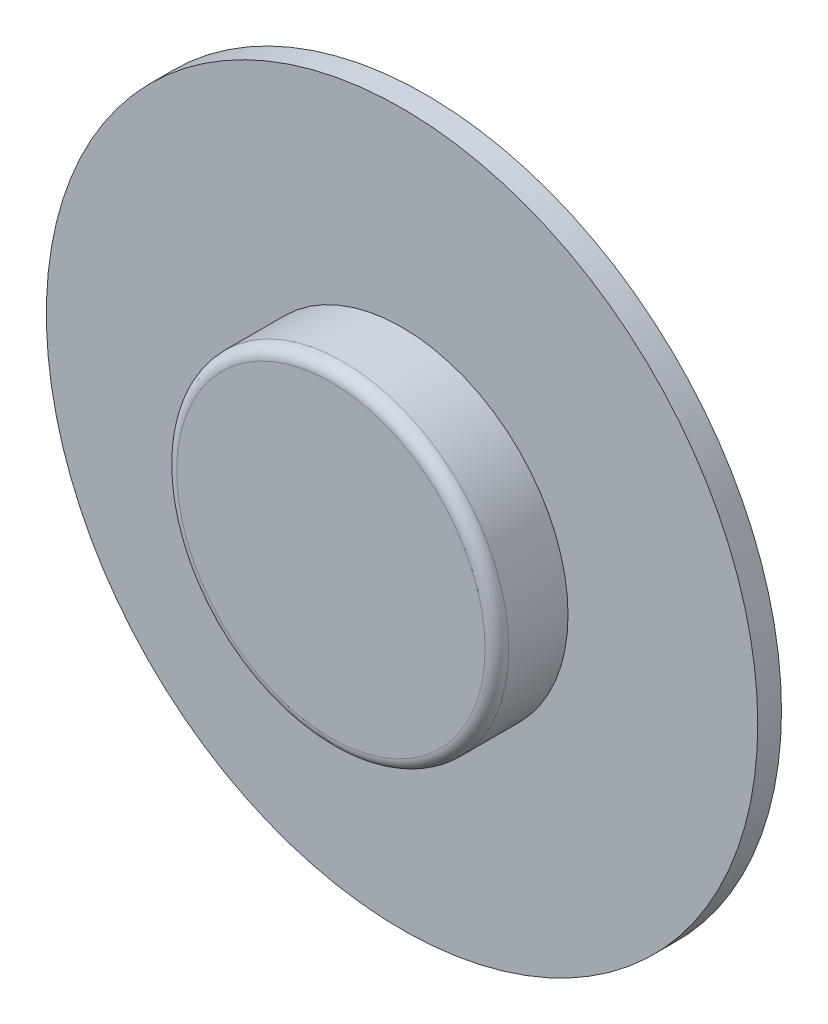
from build123d import *

# Parameters (mm, degrees)
ESQUISSE1_R        = 15
BOSS_EXTRU_1_DEPTH = 1
ESQUISSE2_R        = 7
BOSS_EXTRU_2_DEPTH = 3
CONG_1_R           = 0.5
ESQUISSE3_R        = 4
BOSS_EXTRU_3_DEPTH = 5


with BuildPart() as part:
    # Esquisse1 → Boss.-Extru.1 (new body)
    with BuildSketch(Plane.XY):
        Circle(ESQUISSE1_R)
    extrude(amount=BOSS_EXTRU_1_DEPTH)

    # Esquisse2 → Boss.-Extru.2 (add)
    with BuildSketch(Plane.XY.offset(1)):
        Circle(ESQUISSE2_R)
    extrude(amount=BOSS_EXTRU_2_DEPTH)

    # Congé1
    cong_1_edges = [part.edges().sort_by_distance(p)[0] for p in [
        (-7, 0, 4),
    ]]
    fillet(cong_1_edges, radius=CONG_1_R)

    # Esquisse3 → Boss.-Extru.3 (add)
    with BuildSketch(Plane(origin=(0, 0, 0), x_dir=(-1, 0, 0), z_dir=(0, 0, -1))):
        Circle(ESQUISSE3_R)
    extrude(amount=BOSS_EXTRU_3_DEPTH)


solid = part.part
